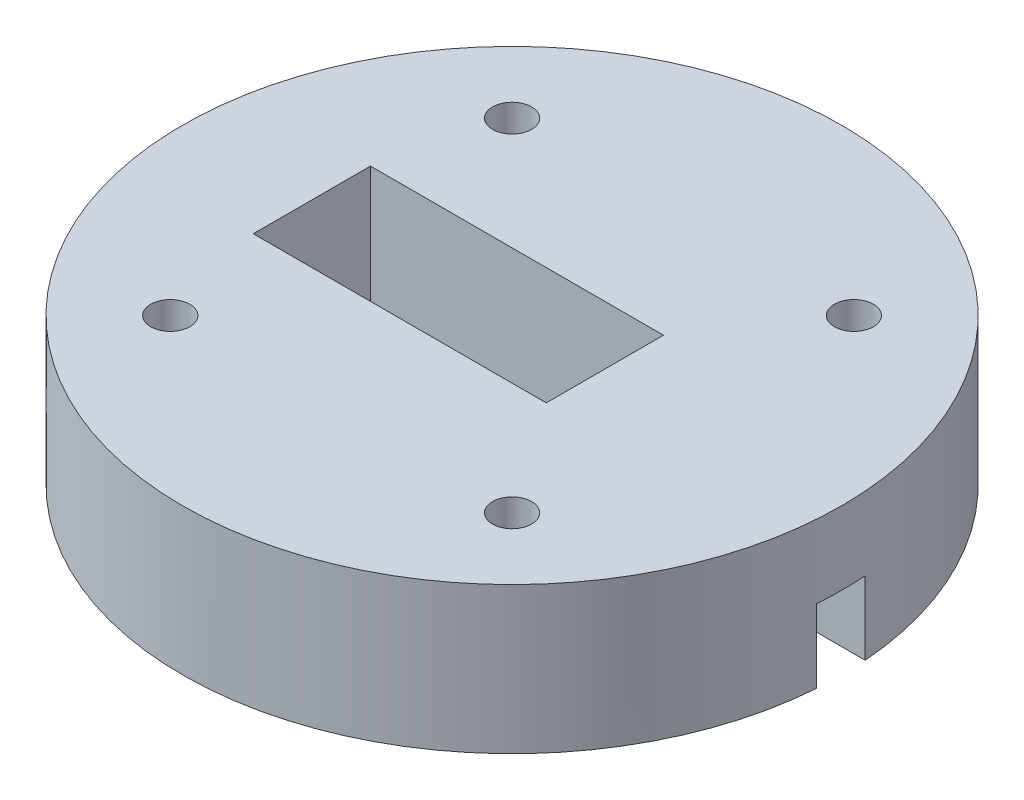
from build123d import *

# Parameters (mm, degrees)
SKETCH_1_R          = 67.5
EXTRUDE_1_DEPTH     = 30
SKETCH_2_W          = 60
SKETCH_2_H          = 24
CUT_EXTRUDE_1_DEPTH = 101.062480481
SKETCH_3_W          = 10
SKETCH_3_H          = 15
CUT_EXTRUDE_2_DEPTH = 97
SKETCH_4_R          = 4
CUT_EXTRUDE_3_DEPTH = 101.062480481


with BuildPart() as part:
    # 草图1 → 凸台-拉伸1 (new body)
    with BuildSketch(Plane(origin=(0, 0, 0), x_dir=(1, 0, 0), z_dir=(0, 1, 0))):
        with Locations(Location((0, 0, 0), (0, 0, 270))):
            Circle(SKETCH_1_R)
    extrude(amount=EXTRUDE_1_DEPTH)

    # 草图2 → 切除-拉伸1 (cut, through all)
    with BuildSketch(Plane(origin=(0, 30, 0), x_dir=(1, 0, 0), z_dir=(0, 1, 0))):
        with Locations((-11, 0)):
            Rectangle(SKETCH_2_W, SKETCH_2_H)
    extrude(amount=-CUT_EXTRUDE_1_DEPTH, mode=Mode.SUBTRACT)

    # 草图3 → 切除-拉伸2 (cut)
    with BuildSketch(Plane(origin=(0, 0, 0), x_dir=(0, 0, -1), z_dir=(1, 0, 0))):
        with Locations((0, 7.5)):
            Rectangle(SKETCH_3_W, SKETCH_3_H)
    extrude(amount=CUT_EXTRUDE_2_DEPTH, mode=Mode.SUBTRACT)

    # 草图4 → 切除-拉伸3 (cut, through all)
    with BuildSketch(Plane(origin=(0, 30, 0), x_dir=(1, 0, 0), z_dir=(0, 1, 0))):
        with Locations(Location((35.001785669, 35.001785669, 0), (0, 0, 270))):
            Circle(SKETCH_4_R)
        with Locations(Location((35.001785669, -35.001785669, 0), (0, 0, 270))):
            Circle(SKETCH_4_R)
        with Locations(Location((-35.001785669, -35.001785669, 0), (0, 0, 270))):
            Circle(SKETCH_4_R)
        with Locations(Location((-35.001785669, 35.001785669, 0), (0, 0, 270))):
            Circle(SKETCH_4_R)
    extrude(amount=-CUT_EXTRUDE_3_DEPTH, mode=Mode.SUBTRACT)


solid = part.part
